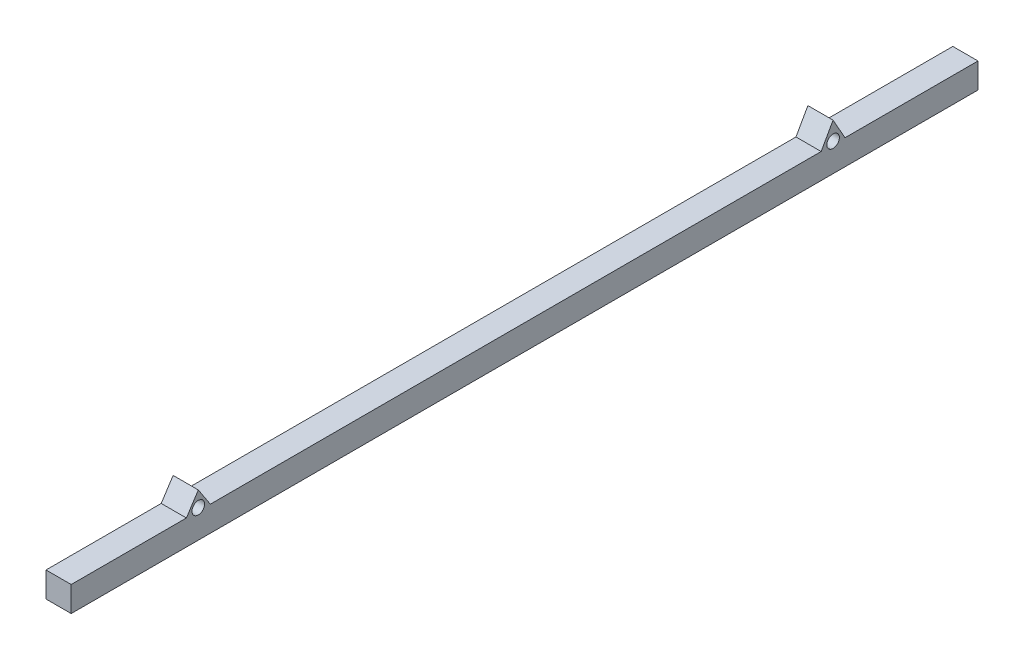
from build123d import *

# Parameters (mm, degrees)
SKETCH1_R           = 1.25
BOSS_EXTRUDE1_DEPTH = 5


with BuildPart() as part:
    # Sketch1 → Boss-Extrude1 (new body)
    with BuildSketch(Plane(origin=(0, 0, 0), x_dir=(0, 0, -1), z_dir=(1, 0, 0))):
        Polygon((25.233, 8.638537032), (22.869893181, 5), (0, 5), (0, 0), (180, 0), (180, 5), (153.59702619, 5), (151.233, 9.21189857), (148.866471386, 5), (27.622231329, 5), align=None)
        with Locations((25.233, 5.593756264)):
            Circle(SKETCH1_R, mode=Mode.SUBTRACT)
        with Locations((151.233, 5.593756264)):
            Circle(SKETCH1_R, mode=Mode.SUBTRACT)
    extrude(amount=-BOSS_EXTRUDE1_DEPTH)


solid = part.part
